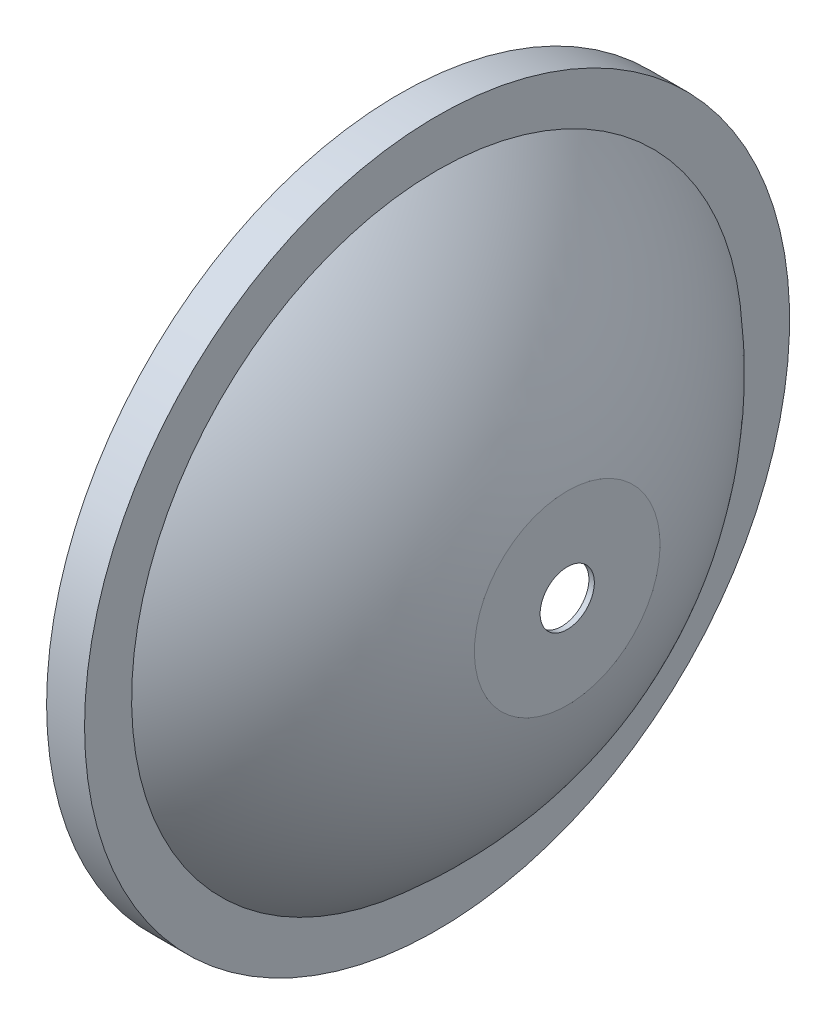
from build123d import *


with BuildPart() as part:
    # Sketch1 → Revolve1 (revolve)
    with BuildSketch(Plane.XY, mode=Mode.PRIVATE) as revolve1_sk:
        with BuildLine():
            Line((-29.992957397, 64), (-23.992957397, 64))
            Line((-23.992957397, 64), (-23.992957397, 55.856960175))
            ThreePointArc((-23.992957397, 55.856960175), (-8.879751576, 38.352961589), (0, 17))
            Line((0, 17), (0, 5))
            Line((0, 5), (1, 5))
            Line((1, 5), (1, 17.117654197))
            ThreePointArc((1, 17.117654197), (-7.875658194, 38.629089315), (-22.992957397, 56.320511361))
            Line((-22.992957397, 56.320511361), (-22.992957397, 65))
            Line((-22.992957397, 65), (-29.992957397, 65))
            Line((-29.992957397, 65), (-29.992957397, 64))
        make_face()
    revolve(revolve1_sk.sketch.rotate(Axis((-47.391304348, 0, 0), (1, 0, 0)), 90), axis=Axis((-47.391304348, 0, 0), (1, 0, 0)))


solid = part.part
